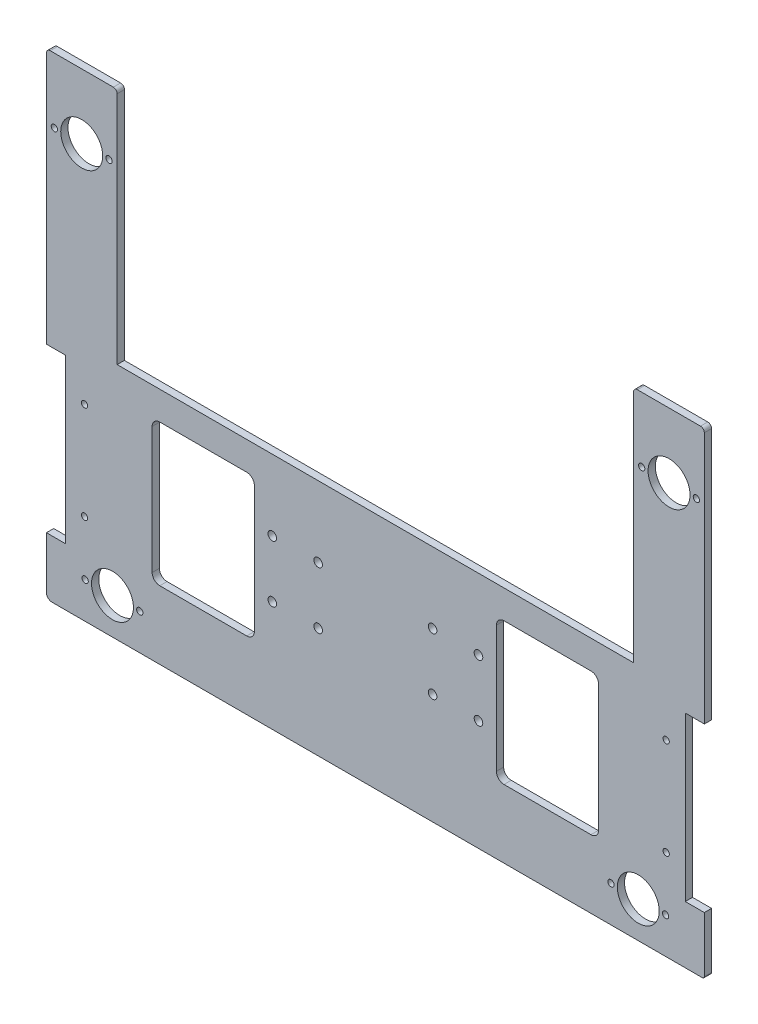
from build123d import *

# Parameters (mm, degrees)
SKETCH2_R           = 1.65
SKETCH2_R_2         = 11
SKETCH2_R_3         = 2.25
BOSS_EXTRUDE1_DEPTH = 3.8


with BuildPart() as part:
    # Sketch2 → Boss-Extrude1 (new body)
    with BuildSketch(Plane.XY):
        with BuildLine():
            Line((-170.5, 150), (-137.4, 150))
            ThreePointArc((-137.4, 150), (-135.985786438, 149.414213562), (-135.4, 148))
            Line((-135.4, 148), (-135.4, 25))
            Line((-135.4, 25), (135.4, 25))
            Line((135.4, 25), (135.4, 148))
            ThreePointArc((135.4, 148), (135.985786438, 149.414213562), (137.4, 150))
            Line((137.4, 150), (170.5, 150))
            ThreePointArc((170.5, 150), (171.914213562, 149.414213562), (172.5, 148))
            Line((172.5, 148), (172.5, 15.719548835))
            Line((172.5, 15.719548835), (162.5, 15.719548835))
            Line((162.5, 15.719548835), (162.5, -69.888900965))
            Line((162.5, -69.888900965), (172.5, -69.888900965))
            Line((172.5, -69.888900965), (172.5, -99))
            ThreePointArc((172.5, -99), (172.207106781, -99.707106781), (171.5, -100))
            Line((171.5, -100), (-169.5, -100))
            ThreePointArc((-169.5, -100), (-171.621320344, -99.121320344), (-172.5, -97))
            Line((-172.5, -97), (-172.5, -69.888900965))
            Line((-172.5, -69.888900965), (-162.5, -69.888900965))
            Line((-162.5, -69.888900965), (-162.5, 15.719548835))
            Line((-162.5, 15.719548835), (-172.5, 15.719548835))
            Line((-172.5, 15.719548835), (-172.5, 148))
            ThreePointArc((-172.5, 148), (-171.914213562, 149.414213562), (-170.5, 150))
        make_face()
        with Locations(Location((-168.334802826, 116, 0), (0, 0, 180))):
            Circle(SKETCH2_R, mode=Mode.SUBTRACT)
        with Locations(Location((-139.665197174, 116, 0), (0, 0, 180))):
            Circle(SKETCH2_R, mode=Mode.SUBTRACT)
        with Locations(Location((168.334802826, 116, 0), (0, 0, 180))):
            Circle(SKETCH2_R, mode=Mode.SUBTRACT)
        with Locations(Location((139.665197174, 116, 0), (0, 0, 180))):
            Circle(SKETCH2_R, mode=Mode.SUBTRACT)
        with Locations(Location((154, 116, 0), (0, 0, 180))):
            Circle(SKETCH2_R_2, mode=Mode.SUBTRACT)
        with Locations(Location((-154, 116, 0), (0, 0, 180))):
            Circle(SKETCH2_R_2, mode=Mode.SUBTRACT)
        with Locations(Location((152.5, -52.584676065, 0), (0, 0, 180))):
            Circle(SKETCH2_R, mode=Mode.SUBTRACT)
        with Locations(Location((152.5, -1.584676065, 0), (0, 0, 180))):
            Circle(SKETCH2_R, mode=Mode.SUBTRACT)
        with Locations(Location((-152.5, -52.584676065, 0), (0, 0, 180))):
            Circle(SKETCH2_R, mode=Mode.SUBTRACT)
        with Locations(Location((-152.5, -1.584676065, 0), (0, 0, 180))):
            Circle(SKETCH2_R, mode=Mode.SUBTRACT)
        with Locations(Location((-30, -42.029676065, 0), (0, 0, 180))):
            Circle(SKETCH2_R_3, mode=Mode.SUBTRACT)
        with Locations(Location((-30, -12.139676065, 0), (0, 0, 180))):
            Circle(SKETCH2_R_3, mode=Mode.SUBTRACT)
        with Locations(Location((-54.06, -12.139676065, 0), (0, 0, 180))):
            Circle(SKETCH2_R_3, mode=Mode.SUBTRACT)
        with Locations(Location((-54.06, -42.029676065, 0), (0, 0, 180))):
            Circle(SKETCH2_R_3, mode=Mode.SUBTRACT)
        with Locations(Location((54.06, -42.029676065, 0), (0, 0, 180))):
            Circle(SKETCH2_R_3, mode=Mode.SUBTRACT)
        with Locations(Location((30, -42.029676065, 0), (0, 0, 180))):
            Circle(SKETCH2_R_3, mode=Mode.SUBTRACT)
        with Locations(Location((30, -12.139676065, 0), (0, 0, 180))):
            Circle(SKETCH2_R_3, mode=Mode.SUBTRACT)
        with Locations(Location((54.06, -12.139676065, 0), (0, 0, 180))):
            Circle(SKETCH2_R_3, mode=Mode.SUBTRACT)
        with Locations(Location((-123.526576723, -81.066130201, 0), (0, 0, 180))):
            Circle(SKETCH2_R, mode=Mode.SUBTRACT)
        with Locations(Location((-152.186576723, -81.066130201, 0), (0, 0, 180))):
            Circle(SKETCH2_R, mode=Mode.SUBTRACT)
        with Locations(Location((-137.856576723, -81.066130201, 0), (0, 0, 180))):
            Circle(SKETCH2_R_2, mode=Mode.SUBTRACT)
        with Locations(Location((123.526576723, -81.066130201, 0), (0, 0, 180))):
            Circle(SKETCH2_R, mode=Mode.SUBTRACT)
        with Locations(Location((152.186576723, -81.066130201, 0), (0, 0, 180))):
            Circle(SKETCH2_R, mode=Mode.SUBTRACT)
        with Locations(Location((137.856576723, -81.066130201, 0), (0, 0, 180))):
            Circle(SKETCH2_R_2, mode=Mode.SUBTRACT)
        with BuildLine():
            Line((-67.457425662, 10.086727014), (-113.055173681, 10.086727014))
            ThreePointArc((-113.055173681, 10.086727014), (-115.883600806, 8.915154139), (-117.055173681, 6.086727014))
            Line((-117.055173681, 6.086727014), (-117.055173681, -60.256079145))
            ThreePointArc((-117.055173681, -60.256079145), (-115.883600806, -63.084506269), (-113.055173681, -64.256079145))
            Line((-113.055173681, -64.256079145), (-67.457425662, -64.256079145))
            ThreePointArc((-67.457425662, -64.256079145), (-64.628998537, -63.084506269), (-63.457425662, -60.256079145))
            Line((-63.457425662, -60.256079145), (-63.457425662, 6.086727014))
            ThreePointArc((-63.457425662, 6.086727014), (-64.628998537, 8.915154139), (-67.457425662, 10.086727014))
        make_face(mode=Mode.SUBTRACT)
        with BuildLine():
            Line((67.457425662, 10.086727014), (113.055173681, 10.086727014))
            ThreePointArc((113.055173681, 10.086727014), (115.883600806, 8.915154139), (117.055173681, 6.086727014))
            Line((117.055173681, 6.086727014), (117.055173681, -60.256079145))
            ThreePointArc((117.055173681, -60.256079145), (115.883600806, -63.084506269), (113.055173681, -64.256079145))
            Line((113.055173681, -64.256079145), (67.457425662, -64.256079145))
            ThreePointArc((67.457425662, -64.256079145), (64.628998537, -63.084506269), (63.457425662, -60.256079145))
            Line((63.457425662, -60.256079145), (63.457425662, 6.086727014))
            ThreePointArc((63.457425662, 6.086727014), (64.628998537, 8.915154139), (67.457425662, 10.086727014))
        make_face(mode=Mode.SUBTRACT)
    extrude(amount=BOSS_EXTRUDE1_DEPTH)


solid = part.part
